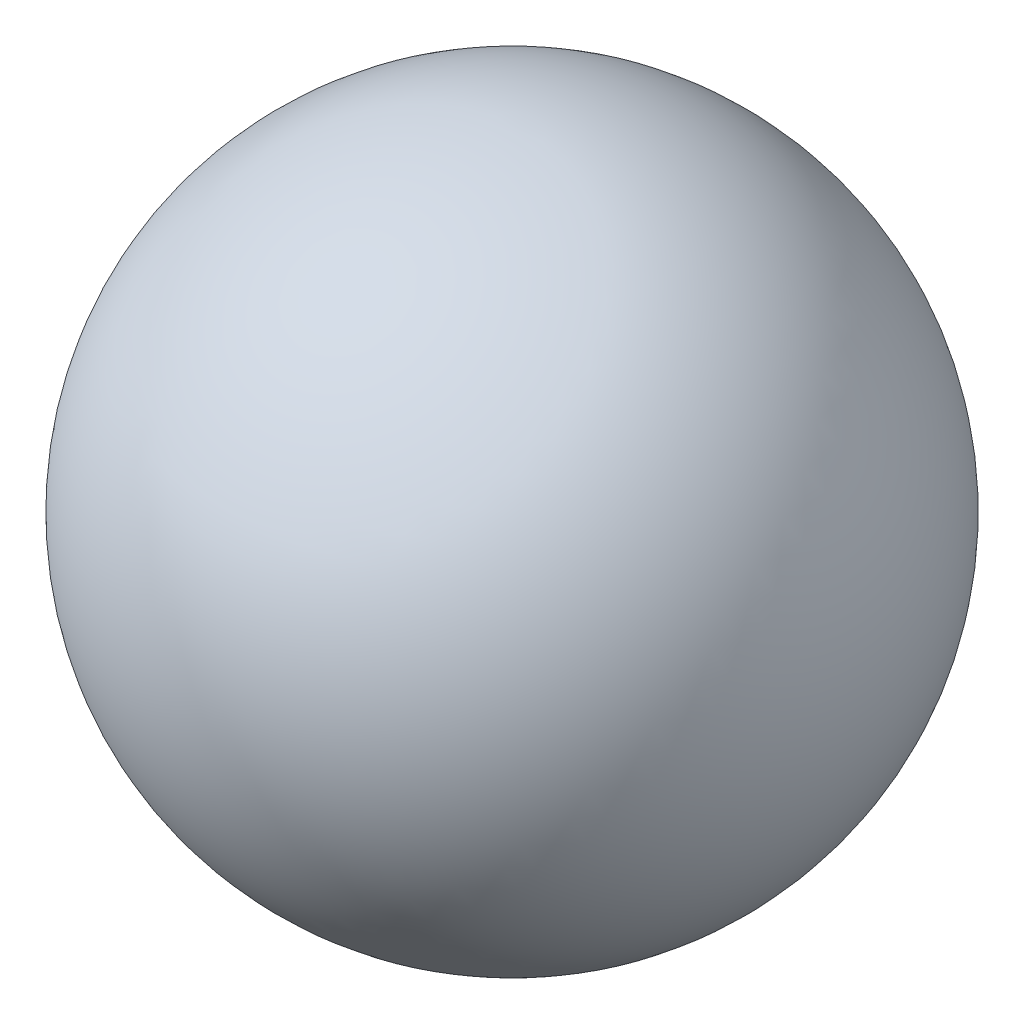
from build123d import *


with BuildPart() as part:
    # Sketch1 → Revolve1 (revolve)
    with BuildSketch(Plane.XY):
        with BuildLine():
            Line((0, 12.5), (0, -12.5))
            ThreePointArc((0, -12.5), (12.5, 0), (0, 12.5))
        make_face()
    revolve(axis=Axis((0, 12.5, 0), (0, -1, 0)))


solid = part.part
